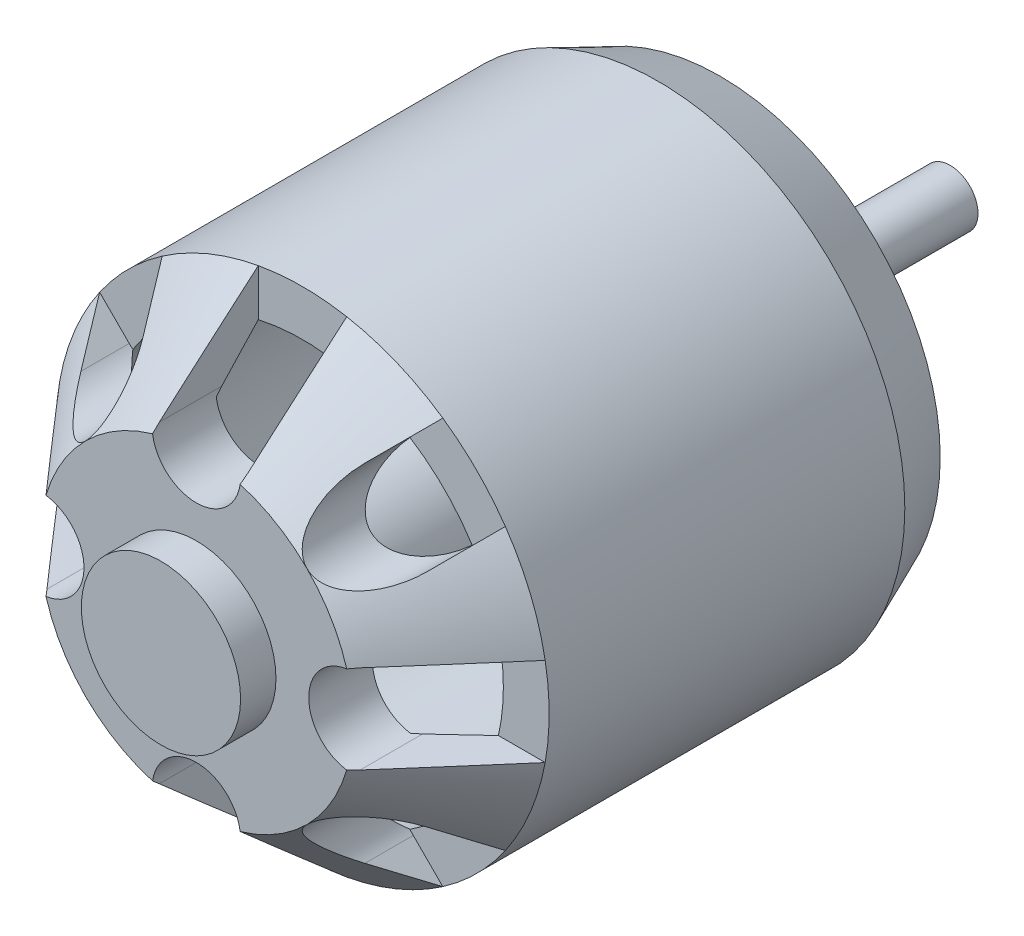
from build123d import *

# Parameters (mm, degrees)
SKETCH_1_R                  = 13.94
EXTRUDE_1_DEPTH             = 31.6
SKETCH_2_R                  = 11.35
CUT_EXTRUDE_1_DEPTH         = 27
CUT_EXTRUDE_START           = -8
SKETCH_3_R                  = 13.94
CUT_EXTRUDE_2_DEPTH         = 8
SKETCH_4_R                  = 4.5
EXTRUDE_2_DEPTH             = 8
EXTRUDE_2_DIRECTION_2_REACH = 32.751
SKETCH_5_R                  = 8.85
EXTRUDE_3_DEPTH             = 3.6
CUT_EXTRUDE_START_2         = -6
CUT_EXTRUDE_3_DEPTH         = 6
PATTERN_CIRCULAR_1_COUNT    = 4
CUT_EXTRUDE_4_DEPTH         = 6
PATTERN_CIRCULAR_2_COUNT    = 4
SKETCH_12_R                 = 1.575
EXTRUDE_4_DEPTH             = 13
CHAMFER_1_SIZE              = 1.5
CHAMFER_1_SIZE2             = 3.5


with BuildPart() as part:
    # 草图1 → 凸台-拉伸1 (new body)
    with BuildSketch(Plane.XY):
        Circle(SKETCH_1_R)
    extrude(amount=EXTRUDE_1_DEPTH)

    # 草图2 → 切除-拉伸1 (cut)
    with BuildSketch(Plane.XY.offset(31.6)):
        Circle(SKETCH_2_R)
    extrude(amount=-CUT_EXTRUDE_1_DEPTH, mode=Mode.SUBTRACT)

    # 草图3 → 切除-拉伸2 (cut)
    with BuildSketch(Plane.XY.offset(31.6).offset(CUT_EXTRUDE_START)):
        Circle(SKETCH_3_R)
    extrude(amount=CUT_EXTRUDE_2_DEPTH, mode=Mode.SUBTRACT)

    # 草图4 → 凸台-拉伸2 (add)
    with BuildSketch(Plane.XY.offset(23.6)):
        Circle(SKETCH_4_R)
    extrude(amount=EXTRUDE_2_DEPTH)

    # 草图4 → 凸台-拉伸2 direction 2 (add, up to next)
    with BuildSketch(Plane.XY.offset(23.6), mode=Mode.PRIVATE) as extrude_2_direction_2_sk1:
        Circle(SKETCH_4_R)
    extrude_2_direction_2_tool1 = extrude(extrude_2_direction_2_sk1.sketch, amount=-EXTRUDE_2_DIRECTION_2_REACH, mode=Mode.PRIVATE) - part.part
    add(extrude_2_direction_2_tool1.solids().sort_by_distance((0, 0, 23.6))[0])

    # 草图5 → 凸台-拉伸3 (add)
    with BuildSketch(Plane.XY.offset(29.6)):
        Circle(SKETCH_5_R)
    extrude(amount=-EXTRUDE_3_DEPTH)

    # 草图6 → 旋转1 (revolve)
    with BuildSketch(Plane(origin=(0, 0, 0), x_dir=(1, 0, 0), z_dir=(0, 1, 0)), mode=Mode.PRIVATE) as revolve_1_sk:
        Polygon((13.94, -23.6), (8.85, -29.6), (8.85, -26), (11.35, -23.6), align=None)
    revolve(revolve_1_sk.sketch.rotate(Axis((0, 0, -500000), (0, 0, 1)), 180), axis=Axis((0, 0, -500000), (0, 0, 1)))

    # 草图7 → 切除-拉伸3 (cut)
    with BuildSketch(Plane.XY.offset(29.6).offset(CUT_EXTRUDE_START_2)):
        with BuildLine():
            Line((-8.85, 2.5), (-13.713992854, 2.5))
            ThreePointArc((-13.713992854, 2.5), (-13.94, 0), (-13.713992854, -2.5))
            Line((-13.713992854, -2.5), (-8.85, -2.5))
            ThreePointArc((-8.85, -2.5), (-6.35, 0), (-8.85, 2.5))
        make_face()
    cut_extrude_3 = extrude(amount=CUT_EXTRUDE_3_DEPTH, mode=Mode.SUBTRACT)

    # 阵列(圆周)1: 切除-拉伸3 ×4 about axis
    pattern_circular_1_axis = Axis((0, 0, 0), (0, 0, 1))
    for i in range(1, PATTERN_CIRCULAR_1_COUNT):
        add(cut_extrude_3.rotate(pattern_circular_1_axis, i * 360 / PATTERN_CIRCULAR_1_COUNT), mode=Mode.SUBTRACT)

    # 草图9 → 切除-拉伸4 (cut)
    with BuildSketch(Plane.XY.offset(29.6).offset(CUT_EXTRUDE_START_2)):
        with BuildLine():
            Line((-9.793428919, 6.257895014), (-11.465024297, 7.929490391))
            ThreePointArc((-11.465024297, 7.929490391), (-9.85706853, 9.85706853), (-7.929490391, 11.465024297))
            Line((-7.929490391, 11.465024297), (-6.257895014, 9.793428919))
            ThreePointArc((-6.257895014, 9.793428919), (-6.257895014, 6.257895014), (-9.793428919, 6.257895014))
        make_face()
    cut_extrude_4 = extrude(amount=CUT_EXTRUDE_4_DEPTH, mode=Mode.SUBTRACT)

    # 阵列(圆周)2: 切除-拉伸4 ×4 about axis
    pattern_circular_2_axis = Axis((0, 0, 0), (0, 0, 1))
    for i in range(1, PATTERN_CIRCULAR_2_COUNT):
        add(cut_extrude_4.rotate(pattern_circular_2_axis, i * 360 / PATTERN_CIRCULAR_2_COUNT), mode=Mode.SUBTRACT)

    # 草图12 → 凸台-拉伸4 (add)
    with BuildSketch(Plane(origin=(0, 0, 0), x_dir=(-1, 0, 0), z_dir=(0, 0, -1))):
        with Locations(Location((0, 0, 0), (0, 0, 180))):
            Circle(SKETCH_12_R)
    extrude(amount=EXTRUDE_4_DEPTH)

    # 倒角1
    chamfer_1_edges = [part.edges().sort_by_distance(p)[0] for p in [
        (-13.94, 0, 0),
    ]]
    chamfer_1_side = [part.faces().sort_by_distance(p)[0] for p in [
        (-13.545717259, 0, 0),
    ]]
    chamfer(chamfer_1_edges, length=CHAMFER_1_SIZE, length2=CHAMFER_1_SIZE2, reference=chamfer_1_side[0])


solid = part.part
